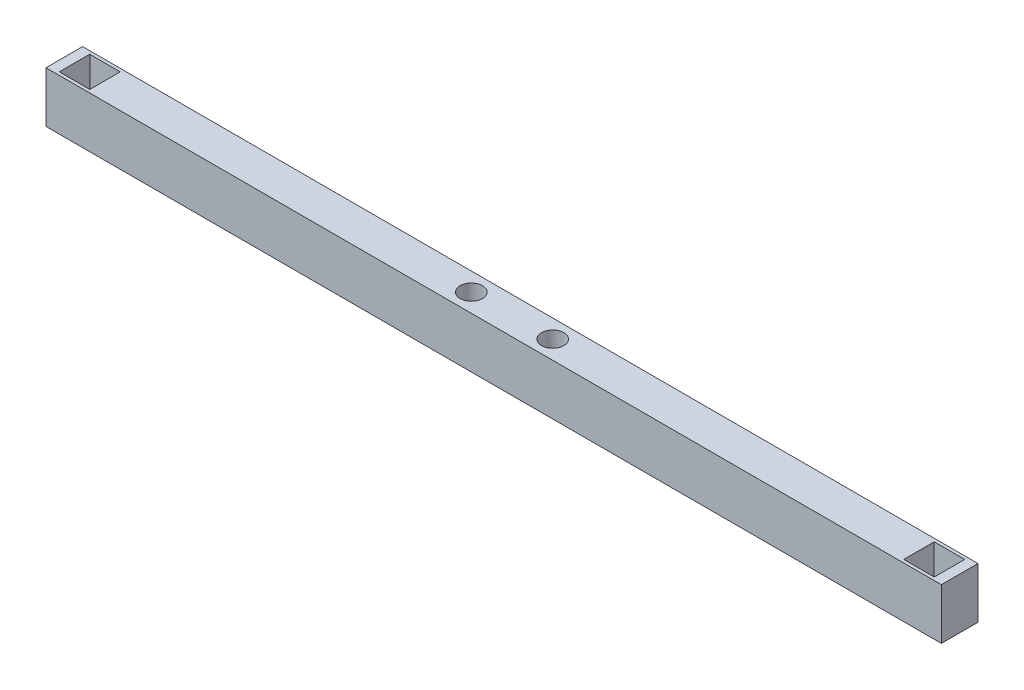
from build123d import *

# Parameters (mm, degrees)
SKETCH1_W           = 880
SKETCH1_H           = 36
BOSS_EXTRUDE1_DEPTH = 50
SKETCH2_W           = 30
SKETCH2_H           = 30
CUT_EXTRUDE1_DEPTH  = 50
SKETCH3_R           = 11
CUT_EXTRUDE2_DEPTH  = 50


with BuildPart() as part:
    # Sketch1 → Boss-Extrude1 (new body)
    with BuildSketch(Plane(origin=(0, 0, 0), x_dir=(1, 0, 0), z_dir=(0, 1, 0))):
        Rectangle(SKETCH1_W, SKETCH1_H)
    extrude(amount=BOSS_EXTRUDE1_DEPTH)

    # Sketch2 → Cut-Extrude1 (cut)
    with BuildSketch(Plane(origin=(0, 50, 0), x_dir=(1, 0, 0), z_dir=(0, 1, 0))):
        with Locations((-415, 0)):
            Rectangle(SKETCH2_W, SKETCH2_H)
        with Locations((415, 0)):
            Rectangle(SKETCH2_W, SKETCH2_H)
    extrude(amount=-CUT_EXTRUDE1_DEPTH, mode=Mode.SUBTRACT)

    # Sketch3 → Cut-Extrude2 (cut)
    with BuildSketch(Plane(origin=(0, 50, 0), x_dir=(1, 0, 0), z_dir=(0, 1, 0))):
        with Locations(Location((-40, 0, 0), (0, 0, 270))):
            Circle(SKETCH3_R)
        with Locations(Location((40, 0, 0), (0, 0, 270))):
            Circle(SKETCH3_R)
    extrude(amount=-CUT_EXTRUDE2_DEPTH, mode=Mode.SUBTRACT)


solid = part.part
